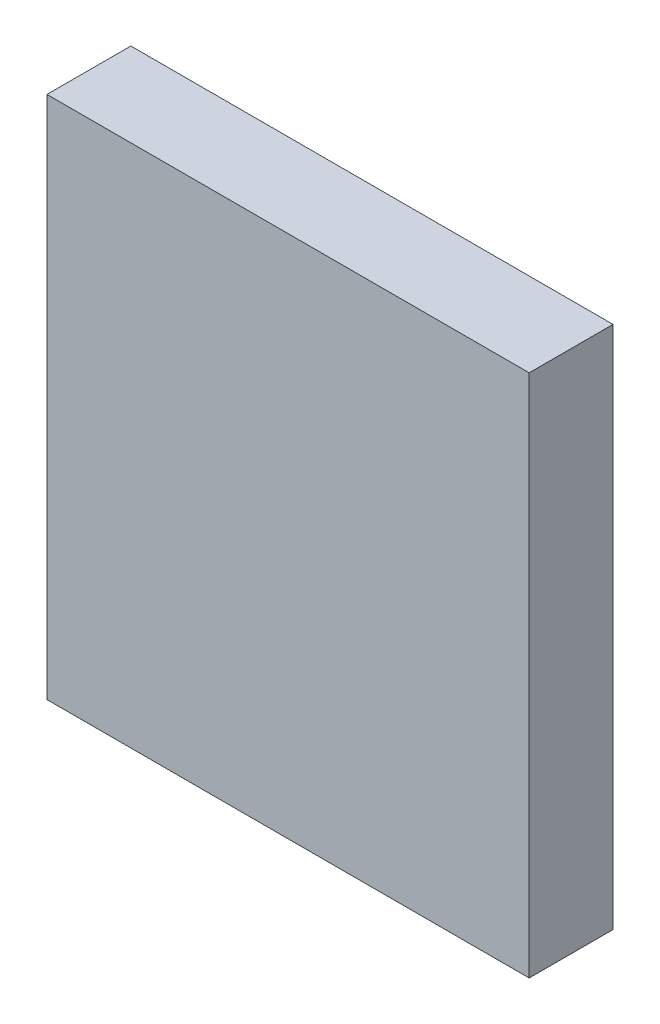
from build123d import *

# Parameters (mm, degrees)
SKETCH1_W           = 46
SKETCH1_H           = 50
BOSS_EXTRUDE1_DEPTH = 8


with BuildPart() as part:
    # Sketch1 → Boss-Extrude1 (new body)
    with BuildSketch(Plane.XY):
        with Locations((3.152928375, -1.033171872)):
            Rectangle(SKETCH1_W, SKETCH1_H)
    extrude(amount=BOSS_EXTRUDE1_DEPTH)


solid = part.part
